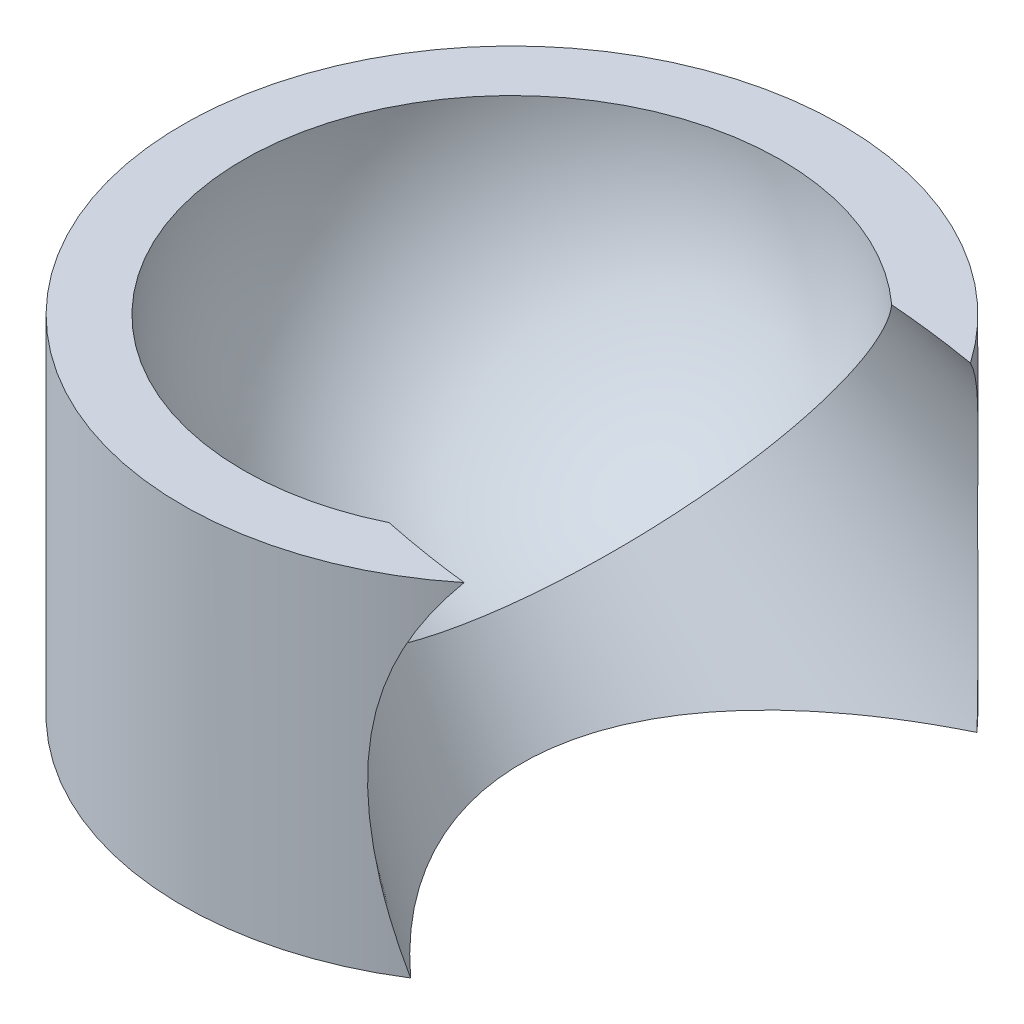
from build123d import *

# Parameters (mm, degrees)
KEYED_BACK_DEPTH   = 0.7
CUP_BLANK_SKETCH_R = 3.8
CUP_BLANK_DEPTH    = 3.3


with BuildPart() as part:
    # Keyed Back Sketch → Keyed Back (new body)
    with BuildSketch(Plane(origin=(0, -97, 0), x_dir=(-1, 0, 0), z_dir=(0, -1, 0))):
        with BuildLine():
            Line((79.27241336, 17.332380758), (79.27241336, 12.667619242))
            ThreePointArc((79.27241336, 12.667619242), (86.07241336, 15), (79.27241336, 17.332380758))
        make_face()
    extrude(amount=KEYED_BACK_DEPTH)

    # Cup Blank Sketch → Cup Blank (add)
    with BuildSketch(Plane(origin=(0, -97.7, 0), x_dir=(-1, 0, 0), z_dir=(0, -1, 0))):
        with Locations(Location((82.27241336, 15, 0), (0, 0, 217.863646362))):
            Circle(CUP_BLANK_SKETCH_R)
    extrude(amount=CUP_BLANK_DEPTH)

    # Spherical Bearing Seat profile → Spherical Bearing Seat (revolve, cut)
    with BuildSketch(Plane(origin=(0, -101, 0), x_dir=(-1, 0, 0), z_dir=(0, -1, 0))):
        with BuildLine():
            Line((82.27241336, 11.9), (82.27241336, 18.1))
            ThreePointArc((82.27241336, 18.1), (79.17241336, 15), (82.27241336, 11.9))
        make_face()
    revolve(axis=Axis((-82.27241336, -101, -25), (0, 0, 1)), mode=Mode.SUBTRACT)

    # Articulation Throat Sketch → Articulation Throat (revolve, cut)
    with BuildSketch(Plane(origin=(21.848129609, -32.292361412, -7.122138515), x_dir=(-0.8343429620590533, -0.5383086561091639, -0.11872494439026368), z_dir=(0.551245699903886, -0.8147619813060819, -0.17969722356136375))):
        Polygon((124.793457491, -7.104979762), (124.793457491, -4.804979762), (101.793457491, 1.915020238), (101.793457491, -7.104979762), align=None)
    revolve(axis=Axis((-90.61584298, -106.383086561, -16.187249444), (0.8343429620590537, 0.5383086561091633, 0.11872494439026321)), mode=Mode.SUBTRACT)


with BuildPart() as body_2:
    # Mirror1: mirrored copy
    add(part.part.mirror(Plane(origin=(0, 0, 0), x_dir=(0, 0, 1), z_dir=(0, -1, 0))))


solid = body_2.part
